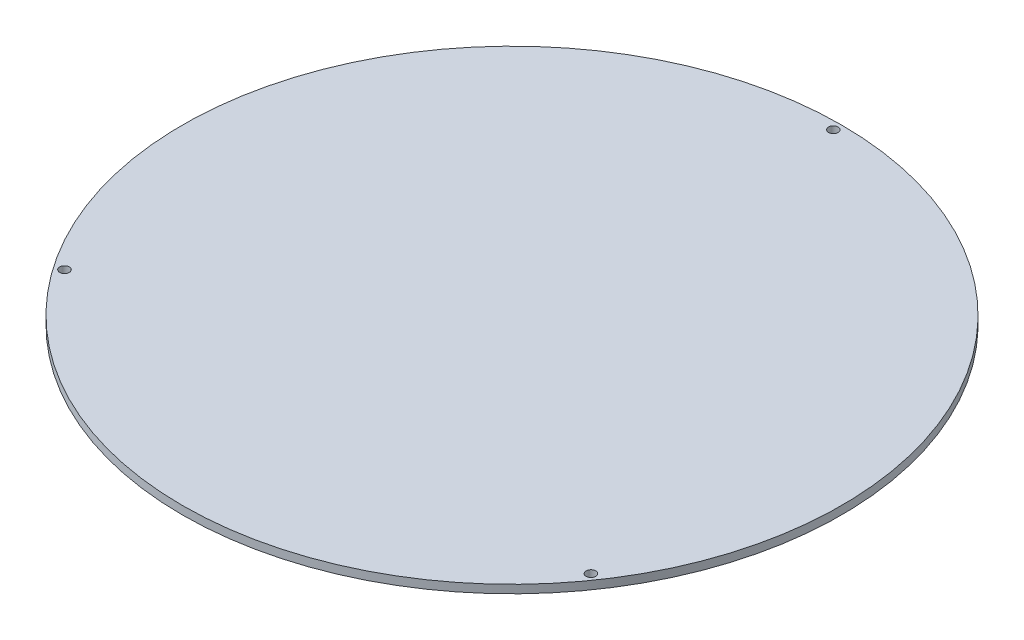
from build123d import *

# Parameters (mm, degrees)
SKETCH1_R               = 120
BOSS_EXTRUDE1_DEPTH     = 3
CUT_EXTRUDE2_DEPTH      = 170.732141918
CUT_EXTRUDE2_DEPTH_BACK = 170.732141918
SKETCH2_R               = 1.75


with BuildPart() as part:
    # Sketch1 → Boss-Extrude1 (new body)
    with BuildSketch(Plane(origin=(0, 0, 0), x_dir=(1, 0, 0), z_dir=(0, 1, 0))):
        with Locations(Location((0, 0, 0), (0, 0, 270))):
            Circle(SKETCH1_R)
    extrude(amount=BOSS_EXTRUDE1_DEPTH)

    # Sketch2 → Cut-Extrude2 (cut, two sides: drawn at the far end of the back side and taken through both)
    with BuildSketch(Plane(origin=(0, 0, 0), x_dir=(1, 0, 0), z_dir=(0, 1, 0)).offset(-CUT_EXTRUDE2_DEPTH_BACK)):
        with Locations(Location((0, 117, 0), (0, 0, 270))):
            Circle(SKETCH2_R)
        with Locations(Location((-95.840789182, -67.108443053, 0), (0, 0, 270))):
            Circle(SKETCH2_R)
        with Locations(Location((95.840789182, -67.108443053, 0), (0, 0, 270))):
            Circle(SKETCH2_R)
    extrude(amount=CUT_EXTRUDE2_DEPTH + CUT_EXTRUDE2_DEPTH_BACK, mode=Mode.SUBTRACT)


solid = part.part
